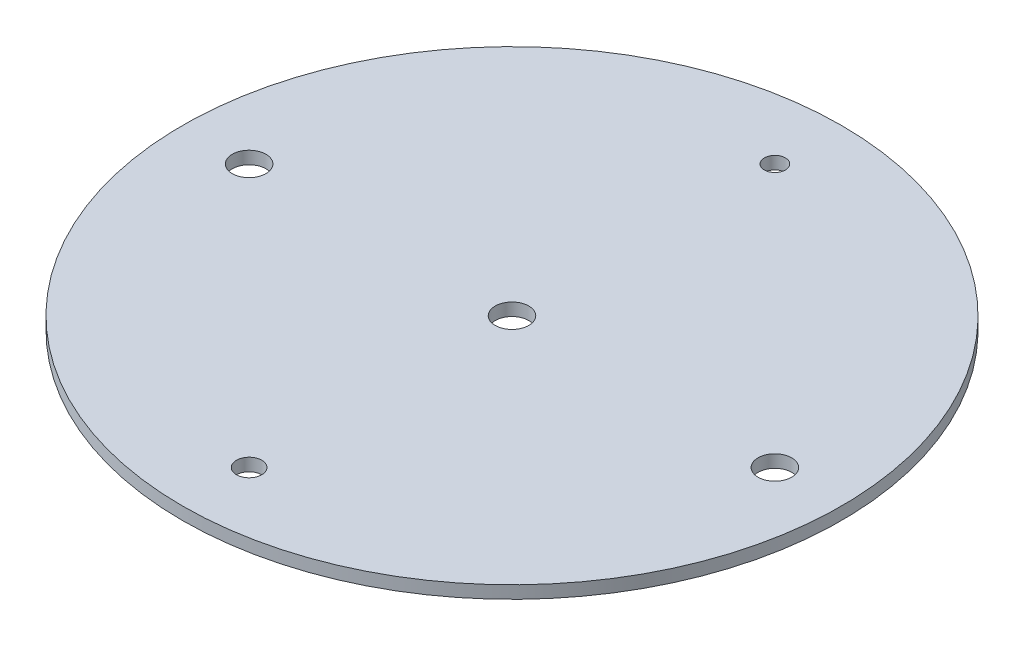
from build123d import *

# Parameters (mm, degrees)
SKETCH1_R           = 78.35
SKETCH1_R_2         = 4
SKETCH1_R_3         = 3
SKETCH1_R_4         = 2.5
BOSS_EXTRUDE1_DEPTH = 3


with BuildPart() as part:
    # Sketch1 → Boss-Extrude1 (new body)
    with BuildSketch(Plane(origin=(0, 0, 0), x_dir=(1, 0, 0), z_dir=(0, 1, 0))):
        with Locations(Location((0, 0, 0), (0, 0, 270))):
            Circle(SKETCH1_R)
        with Locations(Location((-62.5, 0, 0), (0, 0, 270))):
            Circle(SKETCH1_R_2, mode=Mode.SUBTRACT)
        with Locations(Location((0, -62.5, 0), (0, 0, 270))):
            Circle(SKETCH1_R_3, mode=Mode.SUBTRACT)
        with Locations(Location((0, 62.5, 0), (0, 0, 270))):
            Circle(SKETCH1_R_4, mode=Mode.SUBTRACT)
        with Locations(Location((62.5, 0, 0), (0, 0, 270))):
            Circle(SKETCH1_R_2, mode=Mode.SUBTRACT)
        with Locations(Location((0, 0, 0), (0, 0, 270))):
            Circle(SKETCH1_R_2, mode=Mode.SUBTRACT)
    extrude(amount=BOSS_EXTRUDE1_DEPTH)


solid = part.part
